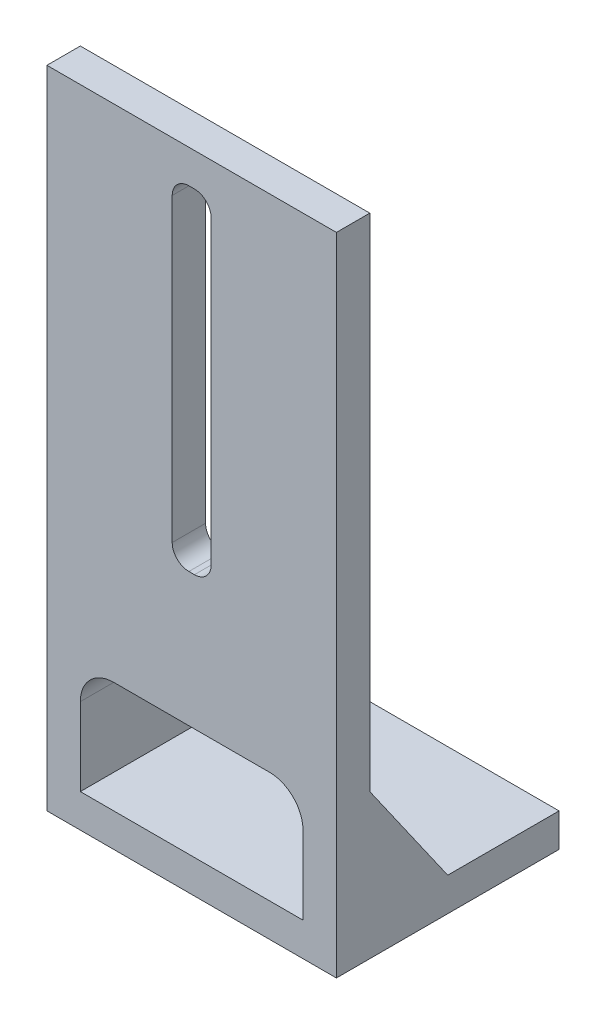
from build123d import *

# Parameters (mm, degrees)
ESBO_O1_W                = 26
ESBO_O1_H                = 20
RESSALTO_EXTRUS_O1_DEPTH = 3
ESBO_O2_W                = 26
ESBO_O2_H                = 3
RESSALTO_EXTRUS_O2_DEPTH = 55
ESBO_O3_W                = 3
ESBO_O3_H                = 7
RESSALTO_EXTRUS_O3_DEPTH = 10
CORTE_EXTRUS_O1_DEPTH    = 65.498700042
CORTE_EXTRUS_O2_REACH    = 66.01
ESBO_O6_W                = 20
ESBO_O6_H                = 10
FILETE1_R                = 3
CORTE_EXTRUS_O3_REACH    = 66.871
ESBO_O7_W                = 1.75
ESBO_O7_H                = 30
FILETE2_R                = 1.5


with BuildPart() as part:
    # Esboço1 → Ressalto-extrusão1 (new body)
    with BuildSketch(Plane(origin=(0, 0, 0), x_dir=(1, 0, 0), z_dir=(0, 1, 0))):
        with Locations((8.077993659, -0.958207295)):
            Rectangle(ESBO_O1_W, ESBO_O1_H)
    extrude(amount=RESSALTO_EXTRUS_O1_DEPTH)

    # Esboço2 → Ressalto-extrusão2 (add)
    with BuildSketch(Plane(origin=(0, 3, 0), x_dir=(1, 0, 0), z_dir=(0, 1, 0))):
        with Locations((8.077993659, -9.458207295)):
            Rectangle(ESBO_O2_W, ESBO_O2_H)
    extrude(amount=RESSALTO_EXTRUS_O2_DEPTH)

    # Esboço3 → Ressalto-extrusão3 (add)
    with BuildSketch(Plane(origin=(0, 3, 0), x_dir=(1, 0, 0), z_dir=(0, 1, 0))):
        with Locations((19.577993659, -4.458207295)):
            Rectangle(ESBO_O3_W, ESBO_O3_H)
        with Locations((-3.422006341, -4.458207295)):
            Rectangle(ESBO_O3_W, ESBO_O3_H)
    extrude(amount=RESSALTO_EXTRUS_O3_DEPTH)

    # Esboço4 → Corte-extrusão1 (cut, through all)
    with BuildSketch(Plane.ZY.offset(4.922006341)):
        Polygon((0.958207295, 3), (7.958207295, 13), (0.958207295, 13), align=None)
    extrude(amount=-CORTE_EXTRUS_O1_DEPTH, mode=Mode.SUBTRACT)

    # Esboço6 → Corte-extrusão2 (cut, up to next)
    with BuildSketch(Plane(origin=(0, 0, 7.958207295), x_dir=(-1, 0, 0), z_dir=(0, 0, -1)), mode=Mode.PRIVATE) as corte_extrus_o2_sk1:
        with Locations((-8.077993659, 8)):
            Rectangle(ESBO_O6_W, ESBO_O6_H)
    corte_extrus_o2_tool1 = extrude(corte_extrus_o2_sk1.sketch, amount=-CORTE_EXTRUS_O2_REACH, mode=Mode.PRIVATE) & part.part
    add(corte_extrus_o2_tool1.solids().sort_by_distance((8.077994, 8, 7.958207))[0], mode=Mode.SUBTRACT)

    # Filete1
    filete1_edges = [part.edges().sort_by_distance(p)[0] for p in [
        (18.077993659, 13, 9.458207295),
        (-1.922006341, 13, 9.458207295),
    ]]
    fillet(filete1_edges, radius=FILETE1_R)

    # Esboço7 → Corte-extrusão3 (cut, up to next)
    with BuildSketch(Plane.XY.offset(10.958207295), mode=Mode.PRIVATE) as corte_extrus_o3_sk1:
        with Locations((7.202993659, 40)):
            Rectangle(ESBO_O7_W, ESBO_O7_H)
    corte_extrus_o3_tool1 = extrude(corte_extrus_o3_sk1.sketch, amount=-CORTE_EXTRUS_O3_REACH, mode=Mode.PRIVATE) & part.part
    # Esboço7 → Corte-extrusão3 (cut, up to next)
    with BuildSketch(Plane.XY.offset(10.958207295), mode=Mode.PRIVATE) as corte_extrus_o3_sk2:
        with Locations((8.952993659, 40)):
            Rectangle(ESBO_O7_W, ESBO_O7_H)
    corte_extrus_o3_tool2 = extrude(corte_extrus_o3_sk2.sketch, amount=-CORTE_EXTRUS_O3_REACH, mode=Mode.PRIVATE) & part.part
    add(corte_extrus_o3_tool1.solids().sort_by_distance((7.202994, 40, 10.958207))[0], mode=Mode.SUBTRACT)
    add(corte_extrus_o3_tool2.solids().sort_by_distance((8.952994, 40, 10.958207))[0], mode=Mode.SUBTRACT)

    # Filete2
    filete2_edges = [part.edges().sort_by_distance(p)[0] for p in [
        (9.827993659, 25, 9.458207295),
        (6.327993659, 25, 9.458207295),
        (6.327993659, 55, 9.458207295),
        (9.827993659, 55, 9.458207295),
    ]]
    fillet(filete2_edges, radius=FILETE2_R)


solid = part.part
